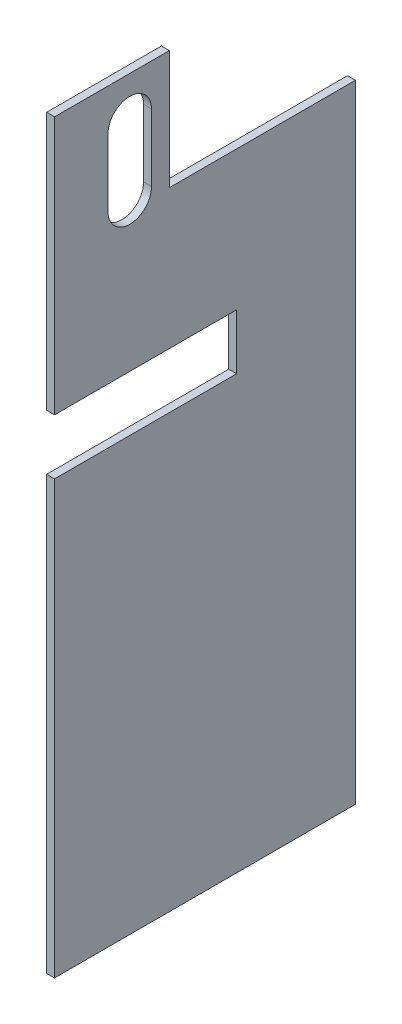
from build123d import *

# Parameters (mm, degrees)
BOSS_EXTRUDE1_DEPTH = 10


with BuildPart() as part:
    # Sketch1 → Boss-Extrude1 (new body)
    with BuildSketch(Plane(origin=(0, 0, 0), x_dir=(0, 0, -1), z_dir=(1, 0, 0))):
        Polygon((0, 616), (230, 616), (230, 546), (0, 546), (0, 0), (380, 0), (380, 792), (145, 792), (145, 942), (0, 942), align=None)
        with BuildLine():
            ThreePointArc((67.5, 804.5), (95, 777), (122.5, 804.5))
            Line((122.5, 804.5), (122.5, 889.5))
            ThreePointArc((122.5, 889.5), (95, 917), (67.5, 889.5))
            Line((67.5, 889.5), (67.5, 804.5))
        make_face(mode=Mode.SUBTRACT)
    extrude(amount=BOSS_EXTRUDE1_DEPTH)


solid = part.part
